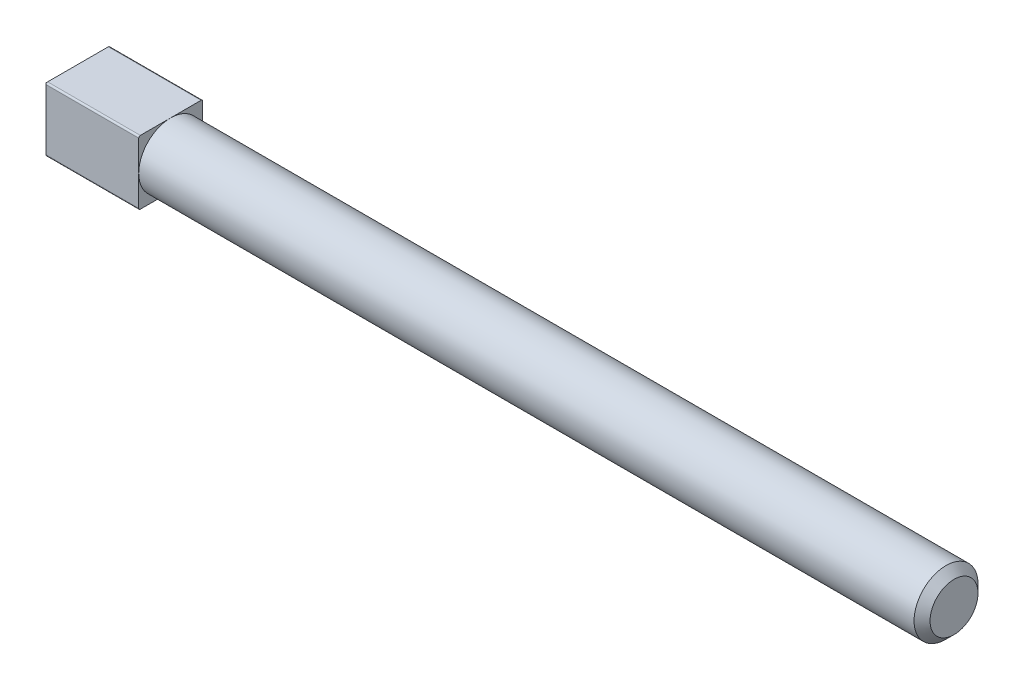
from build123d import *

# Parameters (mm, degrees)
SKETCH_1_W      = 4
SKETCH_1_H      = 4
EXTRUDE_1_DEPTH = 6
SKETCH_2_R      = 2
EXTRUDE_2_DEPTH = 49
CHAMFER_1_SIZE  = 0.5
CHAMFER_2_SIZE  = 0.2
FILLET_1_R      = 0.1


with BuildPart() as part:
    # 草图1 → 凸台-拉伸1 (new body)
    with BuildSketch(Plane(origin=(0, 0, 0), x_dir=(0, 0, -1), z_dir=(1, 0, 0))):
        Rectangle(SKETCH_1_W, SKETCH_1_H)
    extrude(amount=EXTRUDE_1_DEPTH)

    # 草图2 → 凸台-拉伸2 (add)
    with BuildSketch(Plane(origin=(6, 0, 0), x_dir=(0, 0, -1), z_dir=(1, 0, 0))):
        Circle(SKETCH_2_R)
    extrude(amount=EXTRUDE_2_DEPTH)

    # 倒角1
    chamfer_1_edges = [part.edges().sort_by_distance(p)[0] for p in [
        (55, 0, 2),
    ]]
    chamfer(chamfer_1_edges, length=CHAMFER_1_SIZE)

    # 倒角2
    chamfer_2_edges = [part.edges().sort_by_distance(p)[0] for p in [
        (0, 0, 2),
        (0, 2, 0),
        (0, 0, -2),
        (0, -2, 0),
    ]]
    chamfer(chamfer_2_edges, length=CHAMFER_2_SIZE)

    # 圆角1
    fillet_1_edges = [part.edges().sort_by_distance(p)[0] for p in [
        (3.1, -2, 2),
        (3.1, 2, 2),
        (3.1, 2, -2),
        (3.1, -2, -2),
    ]]
    fillet(fillet_1_edges, radius=FILLET_1_R)


solid = part.part
